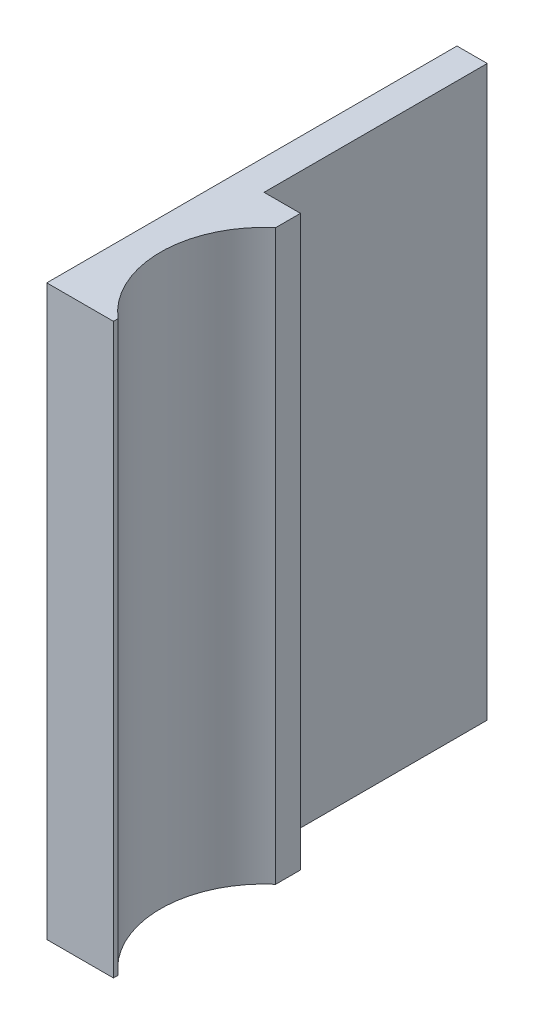
from build123d import *

# Parameters (mm, degrees)
BOSS_EXTRUDE1_DEPTH = 59.69


with BuildPart() as part:
    # Sketch1 → Boss-Extrude1 (new body)
    with BuildSketch(Plane(origin=(0, 0, 0), x_dir=(1, 0, 0), z_dir=(0, 1, 0))):
        with BuildLine():
            Line((3.4975, -21.5265), (-3.4975, -21.5265))
            Line((-3.4975, -21.5265), (-3.4975, 21.5265))
            Line((-3.4975, 21.5265), (-0.3225, 21.5265))
            Line((-0.3225, 21.5265), (-0.3225, -1.8985))
            Line((-0.3225, -1.8985), (3.4975, -1.8985))
            Line((3.4975, -1.8985), (3.4975, -4.493706034))
            ThreePointArc((3.4975, -4.493706034), (-0.3225, -12.7665), (3.4975, -21.039293966))
            Line((3.4975, -21.039293966), (3.4975, -21.5265))
        make_face()
    extrude(amount=BOSS_EXTRUDE1_DEPTH)


solid = part.part
